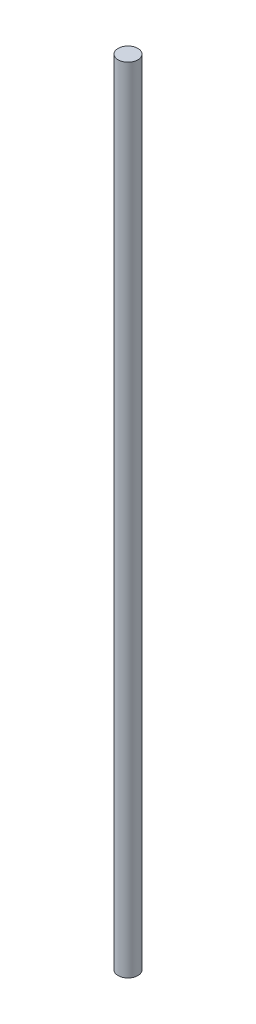
from build123d import *

# Parameters (mm, degrees)
SKETCH_1_R      = 2
EXTRUDE_1_DEPTH = 160


with BuildPart() as part:
    # 草图1 → 凸台-拉伸1 (new body)
    with BuildSketch(Plane(origin=(0, 0, 0), x_dir=(1, 0, 0), z_dir=(0, 1, 0))):
        with Locations(Location((0, 0, 0), (0, 0, 270))):
            Circle(SKETCH_1_R)
    extrude(amount=EXTRUDE_1_DEPTH)


solid = part.part
